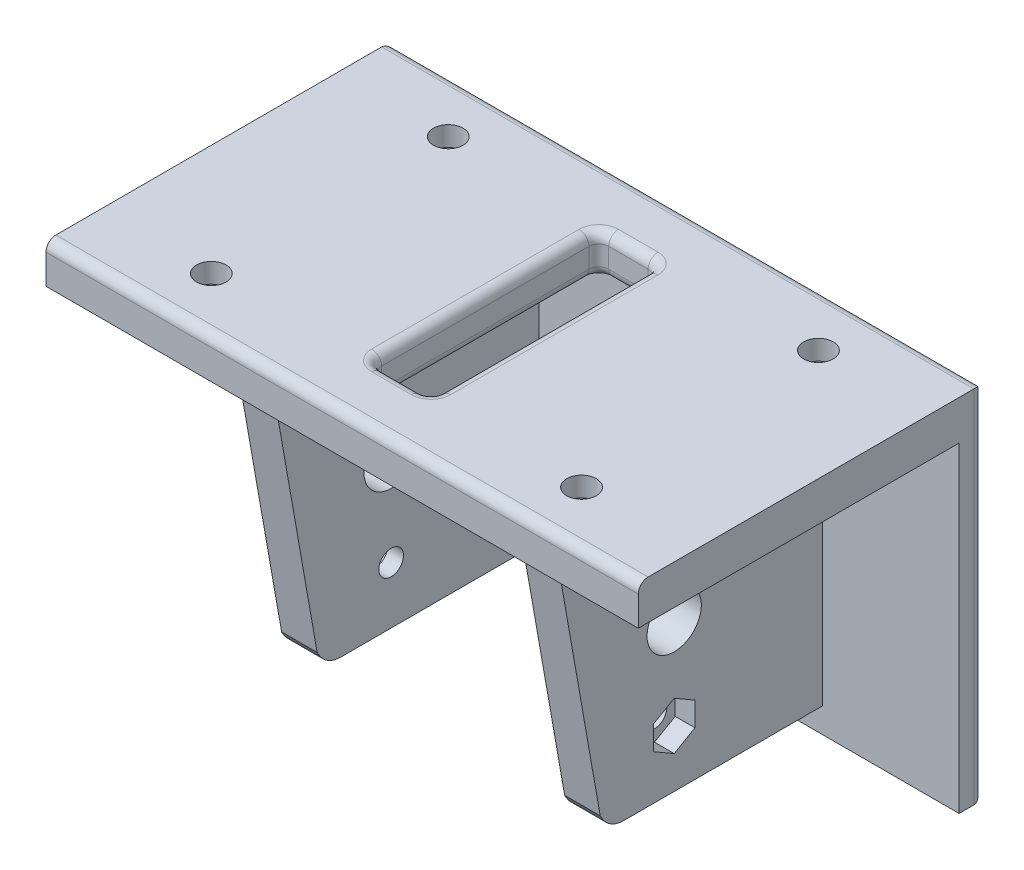
from build123d import *
from OCP.BRepFilletAPI import BRepFilletAPI_MakeChamfer

# Parameters (mm, degrees)
SKETCH1_W               = 120
SKETCH1_H               = 70
SKETCH1_R               = 3
SKETCH1_W_2             = 12
SKETCH1_H_2             = 46
BOSS_EXTRUDE1_DEPTH     = 8
FILLET1_R               = 2
SKETCH2_W               = 120
SKETCH2_H               = 5
BOSS_EXTRUDE2_DEPTH     = 65
SKETCH3_W               = 7.2
SKETCH3_H               = 60
BOSS_EXTRUDE3_DEPTH     = 45
CUT_EXTRUDE1_DEPTH      = 119.172228654
CUT_EXTRUDE1_DEPTH_BACK = 119.172228654
SKETCH4_R               = 5.5
SKETCH4_R_2             = 2.5
CUT_EXTRUDE2_DEPTH      = 4
CUT_EXTRUDE3_DEPTH      = 4
CUT_EXTRUDE4_DEPTH      = 4
CHAMFER1_SIZE           = 10
CHAMFER1_SIZE2          = 56.712818196
FILLET3_R               = 2
CHAMFER2_SIZE           = 2
CHAMFER2_SIZE2          = 3.200669058
FILLET4_R               = 5


with BuildPart() as part:
    # Sketch1 → Boss-Extrude1 (new body)
    with BuildSketch(Plane(origin=(0, 0, 0), x_dir=(1, 0, 0), z_dir=(0, 1, 0))):
        Rectangle(SKETCH1_W, SKETCH1_H)
        with Locations(Location((-37.5, 24, 0), (0, 0, 270))):
            Circle(SKETCH1_R, mode=Mode.SUBTRACT)
        with Locations(Location((-37.5, -24, 0), (0, 0, 90))):
            Circle(SKETCH1_R, mode=Mode.SUBTRACT)
        with Locations(Location((37.5, 24, 0), (0, 0, 90))):
            Circle(SKETCH1_R, mode=Mode.SUBTRACT)
        with Locations(Location((37.5, -24, 0), (0, 0, 270))):
            Circle(SKETCH1_R, mode=Mode.SUBTRACT)
        Rectangle(SKETCH1_W_2, SKETCH1_H_2, mode=Mode.SUBTRACT)
    extrude(amount=BOSS_EXTRUDE1_DEPTH)

    # Fillet1
    fillet1_edges = [part.edges().sort_by_distance(p)[0] for p in [
        (-6, 4, -23),
        (-6, 4, 23),
        (6, 4, 23),
        (6, 4, -23),
    ]]
    fillet(fillet1_edges, radius=FILLET1_R)

    # Sketch2 → Boss-Extrude2 (add)
    with BuildSketch(Plane.XZ):
        with Locations((0, -32.5)):
            Rectangle(SKETCH2_W, SKETCH2_H)
    extrude(amount=BOSS_EXTRUDE2_DEPTH)

    # Sketch3 → Boss-Extrude3 (add)
    with BuildSketch(Plane.XY.offset(-30)):
        with Locations((-28.675, -30)):
            Rectangle(SKETCH3_W, SKETCH3_H)
        with Locations((28.675, -30)):
            Rectangle(SKETCH3_W, SKETCH3_H)
    extrude(amount=BOSS_EXTRUDE3_DEPTH)

    # Sketch4 → Cut-Extrude1 (cut, two sides: drawn at the far end of the back side and taken through both)
    with BuildSketch(Plane.ZY.offset(32.275).offset(-CUT_EXTRUDE1_DEPTH_BACK)):
        with Locations((0, -30)):
            Circle(SKETCH4_R)
        with Locations((0, -11.5)):
            Circle(SKETCH4_R_2)
        with Locations((0, -48.5)):
            Circle(SKETCH4_R_2)
    extrude(amount=CUT_EXTRUDE1_DEPTH + CUT_EXTRUDE1_DEPTH_BACK, mode=Mode.SUBTRACT)

    # Sketch5 → Cut-Extrude2 (cut)
    with BuildSketch(Plane.ZY.offset(32.275)):
        Polygon((4.2, -9.075128869), (0, -6.650257739), (-4.2, -9.075128869), (-4.2, -13.924871131), (0, -16.349742261), (4.2, -13.924871131), align=None)
        Polygon((4.2, -46.075128869), (0, -43.650257739), (-4.2, -46.075128869), (-4.2, -50.924871131), (0, -53.349742261), (4.2, -50.924871131), align=None)
    extrude(amount=-CUT_EXTRUDE2_DEPTH, mode=Mode.SUBTRACT)

    # Sketch6 → Cut-Extrude3 (cut)
    with BuildSketch(Plane(origin=(32.275, 0, 0), x_dir=(0, 0, -1), z_dir=(1, 0, 0))):
        Polygon((4.2, -13.924871131), (4.2, -9.075128869), (0, -6.650257739), (-4.2, -9.075128869), (-4.2, -13.924871131), (0, -16.349742261), align=None)
        Polygon((-4.2, -46.075128869), (-4.2, -50.924871131), (0, -53.349742261), (4.2, -50.924871131), (4.2, -46.075128869), (0, -43.650257739), align=None)
    extrude(amount=-CUT_EXTRUDE3_DEPTH, mode=Mode.SUBTRACT)

    # Sketch7 → Cut-Extrude4 (cut)
    with BuildSketch(Plane.XZ):
        Polygon((42.7, -20.9977786), (37.5, -17.9955572), (32.3, -20.9977786), (32.3, -27.0022214), (37.5, -30.0044428), (42.7, -27.0022214), align=None)
        Polygon((42.7, 27.0022214), (37.5, 30.0044428), (32.3, 27.0022214), (32.3, 20.9977786), (37.5, 17.9955572), (42.7, 20.9977786), align=None)
        Polygon((-42.7, -27.0022214), (-42.7, -20.9977786), (-37.5, -17.9955572), (-32.3, -20.9977786), (-32.3, -27.0022214), (-37.5, -30.0044428), align=None)
        Polygon((-42.7, 20.9977786), (-42.7, 27.0022214), (-37.5, 30.0044428), (-32.3, 27.0022214), (-32.3, 20.9977786), (-37.5, 17.9955572), align=None)
    extrude(amount=-CUT_EXTRUDE4_DEPTH, mode=Mode.SUBTRACT)

    # Chamfer1
    chamfer1_edges = [part.edges().sort_by_distance(p)[0] for p in [
        (28.675, 0, 15),
        (-28.675, 0, 15),
    ]]
    chamfer1_side = [part.faces().sort_by_distance(p)[0] for p in [
        (-58.635265594, 0, 2.5),
    ]]
    chamfer(chamfer1_edges, length=CHAMFER1_SIZE, length2=CHAMFER1_SIZE2, reference=chamfer1_side[0])

    # Fillet3
    fillet3_edges = [part.edges().sort_by_distance(p)[0] for p in [
        (0, 8, 35),
        (0, 0, 23),
        (0, 8, 23),
        (6, 0, 0),
        (6, 8, 0),
        (-6, 0, 0),
        (-6, 8, 0),
        (0, 0, -23),
        (0, 8, -23),
        (5.414213562, 0, 22.414213562),
        (5.414213562, 8, 22.414213562),
        (-5.414213562, 0, 22.414213562),
        (-5.414213562, 8, 22.414213562),
        (5.414213562, 0, -22.414213562),
        (5.414213562, 8, -22.414213562),
        (-5.414213562, 0, -22.414213562),
        (-5.414213562, 8, -22.414213562),
        (0, -65, -35),
        (-60, -28.5, -35),
        (60, -28.5, -35),
        (0, 8, -35),
    ]]
    fillet(fillet3_edges, radius=FILLET3_R)

    # Chamfer2: one chamfer whose edges measure the first distance from different faces: ONE call of the kernel's chamfer builder (chamfer() names one face for all edges)
    chamfer2_edges_1 = [part.edges().sort_by_distance(p)[0] for p in [
        (28.675, -60, 15),
    ]]
    chamfer2_side_1 = [part.faces().sort_by_distance(p)[0] for p in [
        (28.675, -60, -7.5),
    ]]
    chamfer2_edges_2 = [part.edges().sort_by_distance(p)[0] for p in [
        (-28.675, -60, 15),
    ]]
    chamfer2_side_2 = [part.faces().sort_by_distance(p)[0] for p in [
        (-28.675, -60, -7.5),
    ]]
    chamfer2 = BRepFilletAPI_MakeChamfer(part.part.solid().wrapped)
    for e in chamfer2_edges_1:
        chamfer2.Add(CHAMFER2_SIZE, CHAMFER2_SIZE2, e.wrapped, chamfer2_side_1[0].wrapped)  # the first distance lies on this face
    for e in chamfer2_edges_2:
        chamfer2.Add(CHAMFER2_SIZE, CHAMFER2_SIZE2, e.wrapped, chamfer2_side_2[0].wrapped)  # the first distance lies on this face
    add(Compound.cast(chamfer2.Shape()), mode=Mode.REPLACE)

    # Fillet4
    fillet4_edges = [part.edges().sort_by_distance(p)[0] for p in [
        (28.675, -60, 13),
        (-28.675, -60, 13),
    ]]
    fillet(fillet4_edges, radius=FILLET4_R)


solid = part.part
